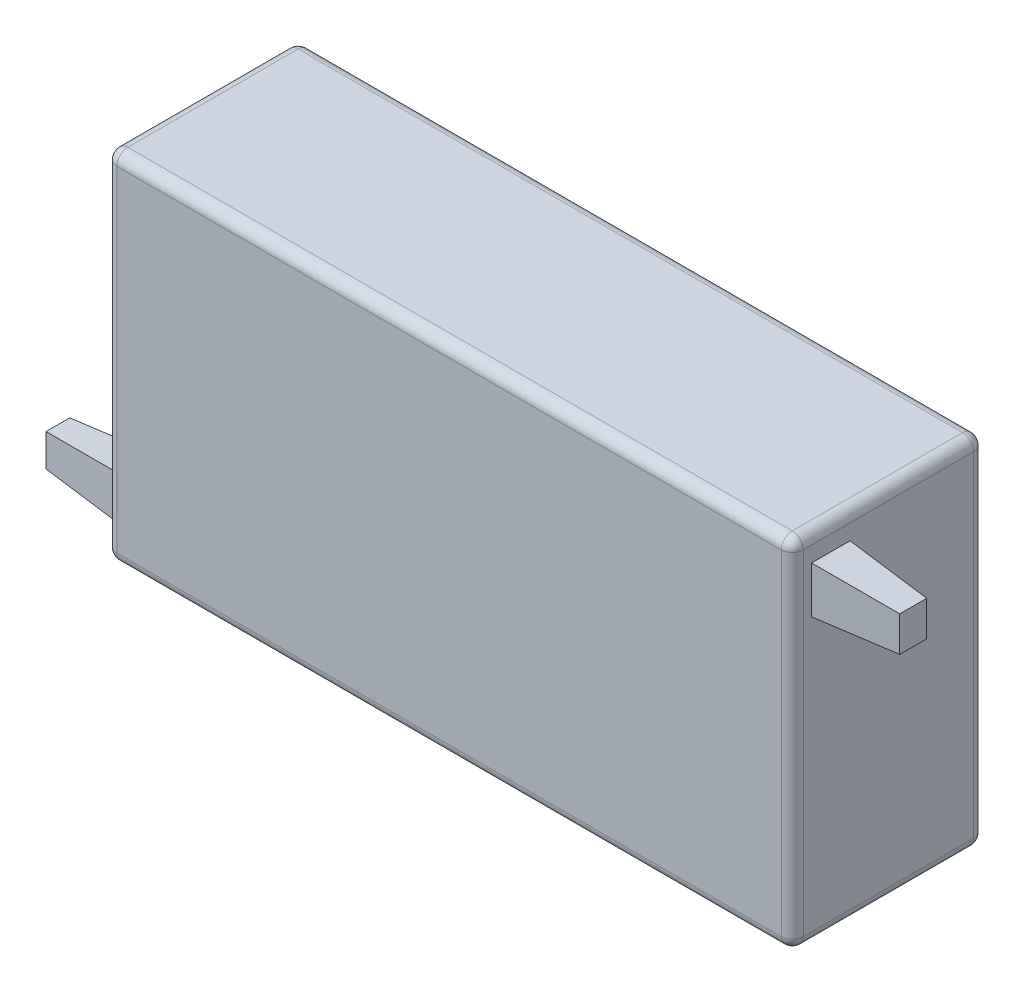
from build123d import *

# Parameters (mm, degrees)
SKETCH1_W           = 125
SKETCH1_H           = 65
BOSS_EXTRUDE1_DEPTH = 35
FILLET1_R           = 2
SKETCH2_W           = 7
SKETCH2_H           = 8.5
BOSS_EXTRUDE2_DEPTH = 15
BOSS_EXTRUDE2_TAPER = 4
SKETCH3_W           = 6.425912995
SKETCH3_H           = 8.003375871
BOSS_EXTRUDE3_DEPTH = 15
BOSS_EXTRUDE3_TAPER = 4


with BuildPart() as part:
    # Sketch1 → Boss-Extrude1 (new body)
    with BuildSketch(Plane.XY):
        Rectangle(SKETCH1_W, SKETCH1_H)
    extrude(amount=BOSS_EXTRUDE1_DEPTH)

    # Fillet1
    fillet1_edges = [part.edges().sort_by_distance(p)[0] for p in [
        (-62.5, 0, 35),
        (0, -32.5, 35),
        (62.5, 0, 35),
        (0, -32.5, 0),
        (-62.5, 0, 0),
        (0, 32.5, 0),
        (62.5, 0, 0),
        (0, 32.5, 35),
        (62.5, -32.5, 17.5),
        (-62.5, -32.5, 17.5),
        (-62.5, 32.5, 17.5),
        (62.5, 32.5, 17.5),
    ]]
    fillet(fillet1_edges, radius=FILLET1_R)

    # Sketch2 → Boss-Extrude2 (add)
    with BuildSketch(Plane(origin=(62.5, 0, 0), x_dir=(0, 0, -1), z_dir=(1, 0, 0))):
        with Locations((-27.977253616, 23.429314173)):
            Rectangle(SKETCH2_W, SKETCH2_H)
    extrude(amount=BOSS_EXTRUDE2_DEPTH, taper=BOSS_EXTRUDE2_TAPER)

    # Sketch3 → Boss-Extrude3 (add)
    with BuildSketch(Plane.ZY.offset(62.5)):
        with Locations((28.744757, -24.829951406)):
            Rectangle(SKETCH3_W, SKETCH3_H)
    extrude(amount=BOSS_EXTRUDE3_DEPTH, taper=BOSS_EXTRUDE3_TAPER)


solid = part.part
